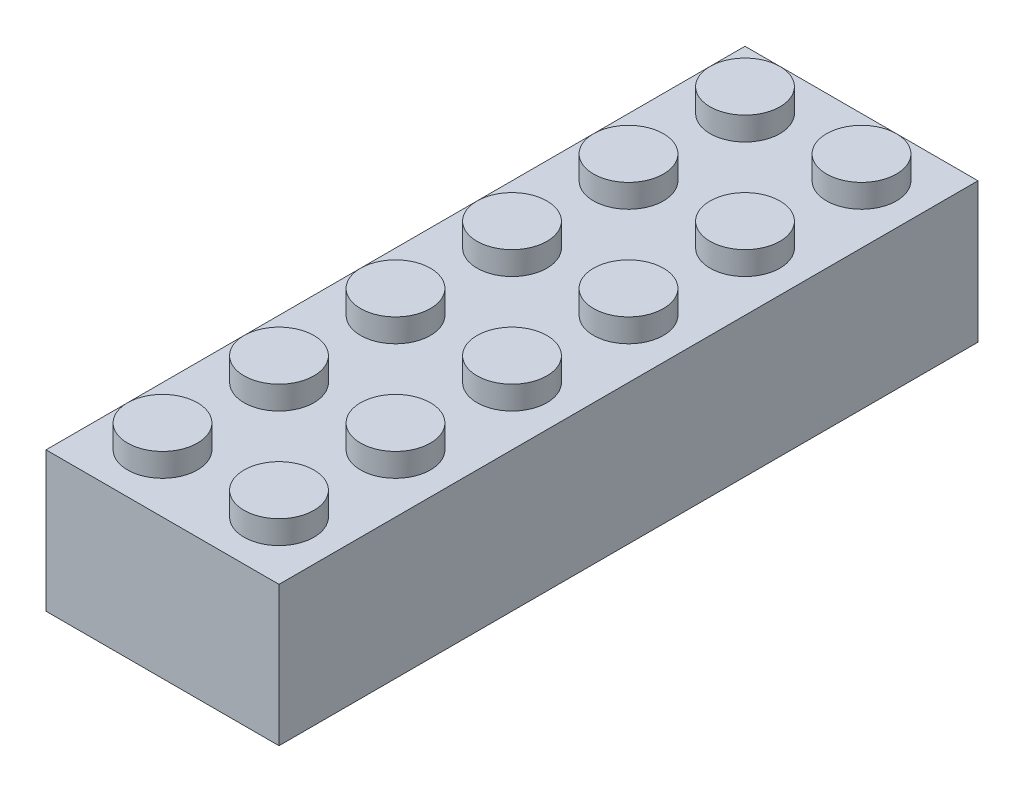
from build123d import *

# Parameters (mm, degrees)
SKETCH1_W            = 16
SKETCH1_H            = 48
BOSS_EXTRUDE1_DEPTH  = 9.6
SKETCH2_R            = 2.4
BOSS_EXTRUDE2_DEPTH  = 1.6
LPATTERN1_COUNT      = 2
LPATTERN1_PITCH      = 8
LPATTERN1_COUNT_DIR2 = 6
LPATTERN1_PITCH_DIR2 = 8
SHELL1_T             = -1.6


with BuildPart() as part:
    # Sketch1 → Boss-Extrude1 (new body)
    with BuildSketch(Plane(origin=(0, 0, 0), x_dir=(1, 0, 0), z_dir=(0, 1, 0))):
        with Locations((8, 24)):
            Rectangle(SKETCH1_W, SKETCH1_H)
    extrude(amount=BOSS_EXTRUDE1_DEPTH)

    # Sketch2 → Boss-Extrude2 (add)
    with BuildSketch(Plane(origin=(0, 9.6, 0), x_dir=(1, 0, 0), z_dir=(0, 1, 0))):
        with Locations(Location((12, 4, 0), (0, 0, 90))):
            Circle(SKETCH2_R)
    boss_extrude2 = extrude(amount=BOSS_EXTRUDE2_DEPTH)

    # LPattern1: Boss-Extrude2 2 × 6
    with Locations(*[(-i * LPATTERN1_PITCH, 0, -j * LPATTERN1_PITCH_DIR2) for i in range(LPATTERN1_COUNT) for j in range(LPATTERN1_COUNT_DIR2) if (i, j) != (0, 0)]):
        add(boss_extrude2)

    # Shell1
    shell1_openings = [part.faces().sort_by_distance(p)[0] for p in [
        (8, 0, -24),
    ]]
    offset(amount=SHELL1_T, openings=shell1_openings, kind=Kind.INTERSECTION)


solid = part.part
